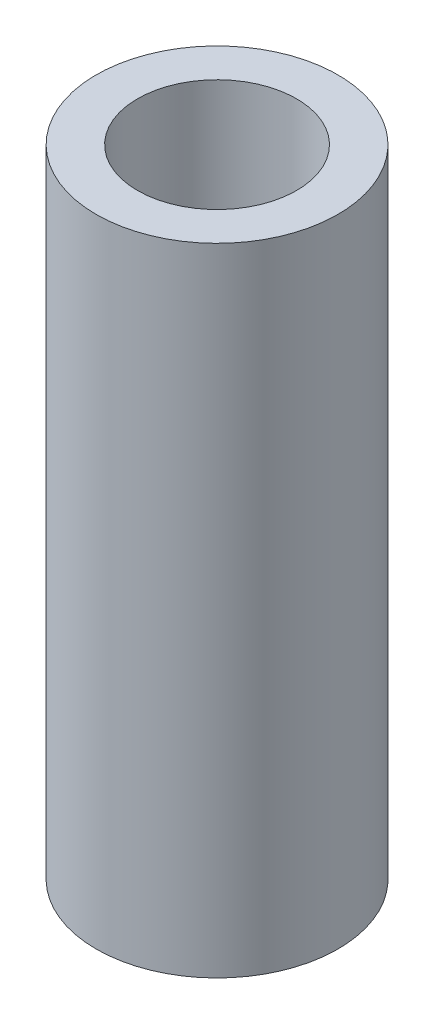
from build123d import *

# Parameters (mm, degrees)
SKETCH1_R           = 9.5
SKETCH1_R_2         = 6.25
BOSS_EXTRUDE1_DEPTH = 50


with BuildPart() as part:
    # Sketch1 → Boss-Extrude1 (new body)
    with BuildSketch(Plane(origin=(0, 0, 0), x_dir=(1, 0, 0), z_dir=(0, 1, 0))):
        with Locations(Location((0, 0, 0), (0, 0, 270))):
            Circle(SKETCH1_R)
        with Locations(Location((0, 0, 0), (0, 0, 270))):
            Circle(SKETCH1_R_2, mode=Mode.SUBTRACT)
    extrude(amount=BOSS_EXTRUDE1_DEPTH)


solid = part.part
